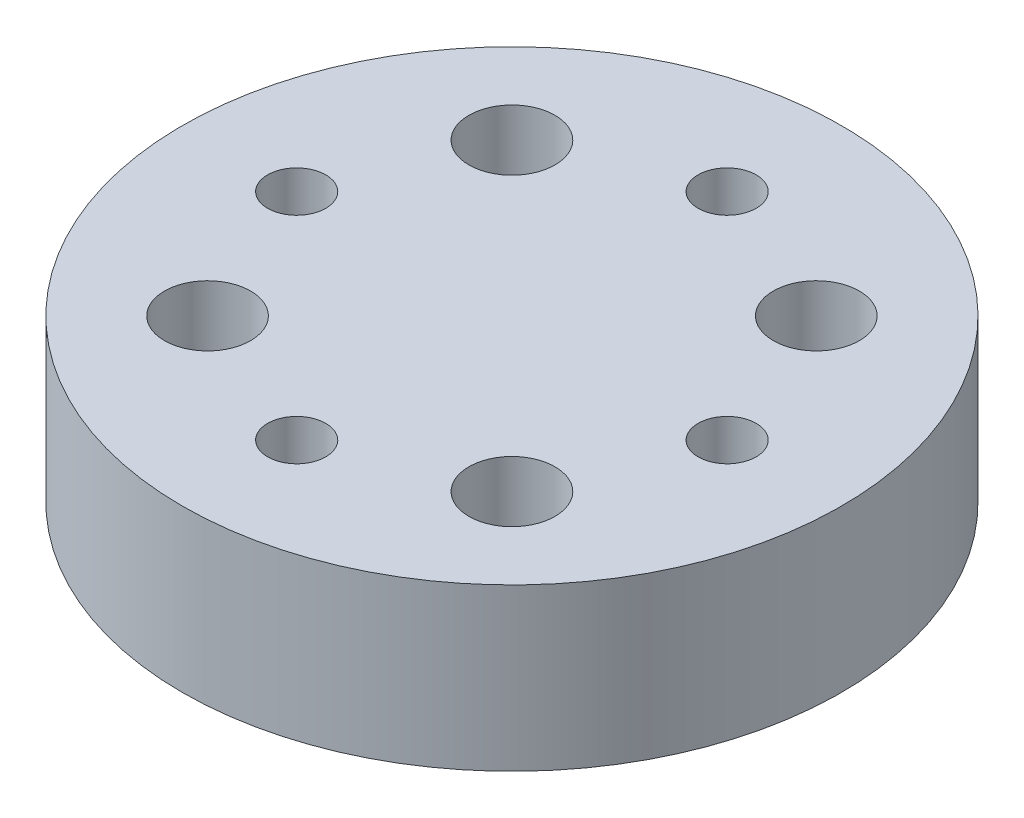
from build123d import *

# Parameters (mm, degrees)
SKETCH_1_R      = 12.25
SKETCH_1_R_2    = 1.08
SKETCH_1_R_3    = 1.6
EXTRUDE_1_DEPTH = 6


with BuildPart() as part:
    # 草图1 → 凸台-拉伸1 (new body)
    with BuildSketch(Plane(origin=(0, 0, 0), x_dir=(1, 0, 0), z_dir=(0, 1, 0))):
        with Locations(Location((0, 0, 0), (0, 0, 270))):
            Circle(SKETCH_1_R)
        with Locations(Location((0, 8, 0), (0, 0, 270))):
            Circle(SKETCH_1_R_2, mode=Mode.SUBTRACT)
        with Locations(Location((8, 0, 0), (0, 0, 270))):
            Circle(SKETCH_1_R_2, mode=Mode.SUBTRACT)
        with Locations(Location((0, -8, 0), (0, 0, 270))):
            Circle(SKETCH_1_R_2, mode=Mode.SUBTRACT)
        with Locations(Location((-8, 0, 0), (0, 0, 270))):
            Circle(SKETCH_1_R_2, mode=Mode.SUBTRACT)
        with Locations(Location((-5.656854249, 5.656854249, 0), (0, 0, 270))):
            Circle(SKETCH_1_R_3, mode=Mode.SUBTRACT)
        with Locations(Location((5.656854249, 5.656854249, 0), (0, 0, 270))):
            Circle(SKETCH_1_R_3, mode=Mode.SUBTRACT)
        with Locations(Location((5.656854249, -5.656854249, 0), (0, 0, 270))):
            Circle(SKETCH_1_R_3, mode=Mode.SUBTRACT)
        with Locations(Location((-5.656854249, -5.656854249, 0), (0, 0, 270))):
            Circle(SKETCH_1_R_3, mode=Mode.SUBTRACT)
    extrude(amount=EXTRUDE_1_DEPTH)


solid = part.part
